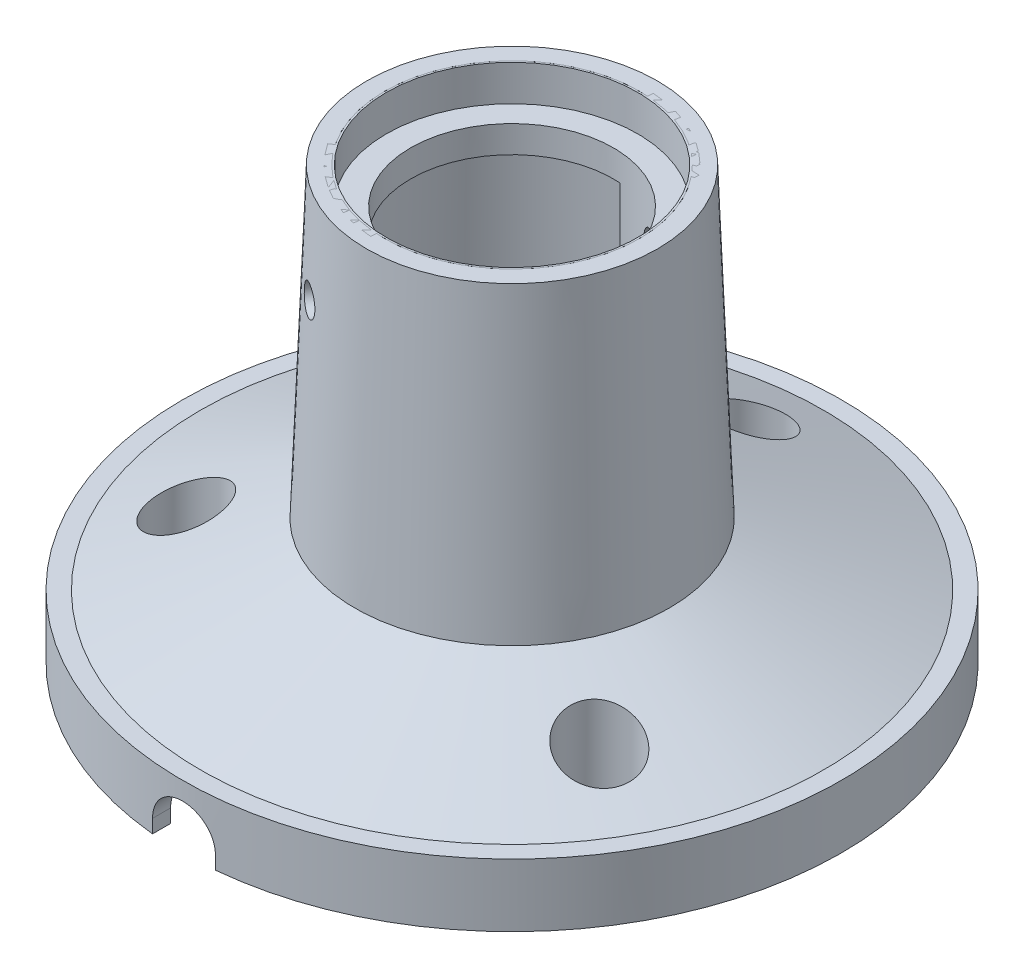
from build123d import *
from build123d.topology import SkipClean

# Parameters (mm, degrees)
SKETCH_4_R               = 3.9
CUT_EXTRUDE_1_DEPTH      = 46
SHELL_3_T                = -2
SKETCH_6_R               = 2.25
CUT_EXTRUDE_2_DEPTH      = 71.694978673
SKETCH_7_R               = 14.198538596
SKETCH_7_R_2             = 11.3
EXTRUDE_1_DEPTH          = 7
EXTRUDE_2_DEPTH          = 16
SKETCH_9_R               = 14
SKETCH_9_R_2             = 11.3
CUT_EXTRUDE_3_DEPTH      = 4
EXTRUDE_3_REACH          = 72.695
CUT_EXTRUDE_4_DEPTH      = 79.20824104
CUT_EXTRUDE_4_DEPTH_BACK = 79.20824104
SKETCH_11_R              = 1.6
CUT_EXTRUDE_5_DEPTH      = 71.694978673


with BuildPart() as part:
    # 스케치2 → 회전1 (revolve)
    with BuildSketch(Plane.XY, mode=Mode.PRIVATE) as revolve_1_sk:
        Polygon((0, 0), (36.7, 0), (36.7, 7), (34.7, 7), (17.5, 14), (16.2, 48), (0, 48), align=None)
    revolve(revolve_1_sk.sketch.rotate(Axis((0, 48, 0), (0, -1, 0)), 180), axis=Axis((0, 48, 0), (0, -1, 0)))

    # 스케치4 → 컷-돌출1 (cut)
    with BuildSketch(Plane(origin=(0, 48, 0), x_dir=(1, 0, 0), z_dir=(0, 1, 0))):
        with Locations(Location((0, 26.558112383, 0), (0, 0, 180))):
            Circle(SKETCH_4_R)
        with Locations(Location((-23, -13.279056191, 0), (0, 0, 180))):
            Circle(SKETCH_4_R)
        with Locations(Location((23, -13.279056191, 0), (0, 0, 180))):
            Circle(SKETCH_4_R)
    extrude(amount=-CUT_EXTRUDE_1_DEPTH, mode=Mode.SUBTRACT)

    # 쉘3
    shell_3_openings = [part.faces().sort_by_distance(p)[0] for p in [
        (0, 48, 0),
        (0, 0, 0),
    ]]
    offset(amount=SHELL_3_T, openings=shell_3_openings, kind=Kind.INTERSECTION)

    # 스케치6 → 컷-돌출2 (cut, through all)
    with BuildSketch(Plane(origin=(0, 48, 0), x_dir=(1, 0, 0), z_dir=(0, 1, 0))):
        with Locations(Location((0, 26.558112383, 0), (0, 0, 180))):
            Circle(SKETCH_6_R)
        with Locations(Location((-23, -13.279056191, 0), (0, 0, 180))):
            Circle(SKETCH_6_R)
        with Locations(Location((23, -13.279056191, 0), (0, 0, 180))):
            Circle(SKETCH_6_R)
    extrude(amount=-CUT_EXTRUDE_2_DEPTH, mode=Mode.SUBTRACT)

    # 보스-돌출3: up to this cone (the profile starts inside it)
    extrude_3_end = Plane(origin=(0, 0, 0), z_dir=(0, -1, 0)).offset(-18.962805039) * Cone(2.457e-06, 340.933803788, 138.752128448, align=(Align.CENTER, Align.CENTER, Align.MIN), mode=Mode.PRIVATE)
    # 스케치10 → 보스-돌출3 (add, up to the surface)
    with BuildSketch(Plane(origin=(0, 0, 0), x_dir=(1, 0, 0), z_dir=(0, 1, 0)), mode=Mode.PRIVATE) as extrude_3_sk1:
        with BuildLine():
            Line((-1, 35.298423202), (-1, 30.327727748))
            ThreePointArc((-1, 30.327727748), (0, 30.458112383), (1, 30.327727748))
            Line((1, 30.327727748), (1, 35.298423202))
            Line((1, 35.298423202), (-1, 35.298423202))
        make_face()
    extrude_3_tool1 = extrude(extrude_3_sk1.sketch, amount=EXTRUDE_3_REACH, mode=Mode.PRIVATE) & extrude_3_end
    add(extrude_3_tool1.solids().sort_by_distance((0, 0, -32.85653))[0])
    # 스케치10 → 보스-돌출3 (add, up to the surface)
    with BuildSketch(Plane(origin=(0, 0, 0), x_dir=(1, 0, 0), z_dir=(0, 1, 0)), mode=Mode.PRIVATE) as extrude_3_sk2:
        with BuildLine():
            Line((31.069331206, -16.783186197), (26.764582669, -14.29783847))
            ThreePointArc((26.764582669, -14.29783847), (26.377499075, -15.229056191), (25.764582669, -16.029889278))
            Line((25.764582669, -16.029889278), (30.069331206, -18.515237005))
            Line((30.069331206, -18.515237005), (31.069331206, -16.783186197))
        make_face()
    extrude_3_tool2 = extrude(extrude_3_sk2.sketch, amount=EXTRUDE_3_REACH, mode=Mode.PRIVATE) & extrude_3_end
    add(extrude_3_tool2.solids().sort_by_distance((28.45459, 0, 16.428265))[0])
    # 스케치10 → 보스-돌출3 (add, up to the surface)
    with BuildSketch(Plane(origin=(0, 0, 0), x_dir=(1, 0, 0), z_dir=(0, 1, 0)), mode=Mode.PRIVATE) as extrude_3_sk3:
        with BuildLine():
            Line((-30.069331206, -18.515237005), (-25.764582669, -16.029889278))
            ThreePointArc((-25.764582669, -16.029889278), (-26.377499075, -15.229056191), (-26.764582669, -14.29783847))
            Line((-26.764582669, -14.29783847), (-31.069331206, -16.783186197))
            Line((-31.069331206, -16.783186197), (-30.069331206, -18.515237005))
        make_face()
    extrude_3_tool3 = extrude(extrude_3_sk3.sketch, amount=EXTRUDE_3_REACH, mode=Mode.PRIVATE) & extrude_3_end
    add(extrude_3_tool3.solids().sort_by_distance((-28.45459, 0, 16.428265))[0])


with BuildPart() as body_2:
    # 스케치7 → 보스-돌출1 (new body)
    with BuildSketch(Plane(origin=(0, 48, 0), x_dir=(1, 0, 0), z_dir=(0, 1, 0))):
        with Locations(Location((0, 0, 0), (0, 0, 180))):
            Circle(SKETCH_7_R)
        with Locations(Location((0, 0, 0), (0, 0, 180))):
            Circle(SKETCH_7_R_2, mode=Mode.SUBTRACT)
    extrude(amount=-EXTRUDE_1_DEPTH)

    # 스케치8 → 보스-돌출2 (add)
    with SkipClean():  # the faces are left unmerged after this step: merging them gives an invalid solid
        with BuildSketch(Plane(origin=(0, 48, 0), x_dir=(1, 0, 0), z_dir=(0, 1, 0))):
            with BuildLine():
                Line((9.396930745, 6.275961486), (12.307484516, 8.219843362))
                ThreePointArc((12.307484516, 8.219843362), (7.4, 12.817175976), (0.964850909, 14.768515928))
                Line((0.964850909, 14.768515928), (0.736676707, 11.275961486))
                ThreePointArc((0.736676707, 11.275961486), (5.65, 9.786087063), (9.396930745, 6.275961486))
            make_face()
            with BuildLine():
                Line((-0.736676707, -11.275961486), (-0.964850909, -14.768515928))
                ThreePointArc((-0.964850909, -14.768515928), (-7.4, -12.817175976), (-12.307484516, -8.219843362))
                Line((-12.307484516, -8.219843362), (-9.396930745, -6.275961486))
                ThreePointArc((-9.396930745, -6.275961486), (-5.65, -9.786087063), (-0.736676707, -11.275961486))
            make_face()
        extrude(amount=-EXTRUDE_2_DEPTH)

    # 스케치9 → 컷-돌출3 (cut)
    with SkipClean():  # the faces are left unmerged after this step: merging them gives an invalid solid
        with BuildSketch(Plane(origin=(0, 48, 0), x_dir=(1, 0, 0), z_dir=(0, 1, 0))):
            with Locations(Location((0, 0, 0), (0, 0, 180))):
                Circle(SKETCH_9_R)
            with Locations(Location((0, 0, 0), (0, 0, 180))):
                Circle(SKETCH_9_R_2, mode=Mode.SUBTRACT)
        extrude(amount=-CUT_EXTRUDE_3_DEPTH, mode=Mode.SUBTRACT)


with BuildPart() as cut_extrude_4_tool:
    # 스케치11 → 컷-돌출4 (new, two sides: drawn at the far end of the back side and taken through both)
    with SkipClean():  # the faces are left unmerged after this step: merging them gives an invalid solid
        with BuildSketch(Plane(origin=(5.066803726, 0, -8.775961486), x_dir=(-0.8660254037844382, 0, -0.500000000000001), z_dir=(0.500000000000001, 0, -0.8660254037844382)).offset(-CUT_EXTRUDE_4_DEPTH_BACK)):
            with Locations((0, 38)):
                Circle(SKETCH_11_R)
        extrude(amount=CUT_EXTRUDE_4_DEPTH + CUT_EXTRUDE_4_DEPTH_BACK)


with BuildPart() as part_1:
    with SkipClean():  # the faces are left unmerged after this step: merging them gives an invalid solid
        add(part.part)

        # 컷-돌출4: cut by cut_extrude_4_tool
        add(cut_extrude_4_tool.part, mode=Mode.SUBTRACT)

    # 스케치12 → 컷-돌출5 (cut, through all)
    with BuildSketch(Plane.XY):
        with BuildLine():
            Line((-3.5, 0), (-3.5, 1.5))
            ThreePointArc((-3.5, 1.5), (0, 5), (3.5, 1.5))
            Line((3.5, 1.5), (3.5, 0))
            ThreePointArc((3.5, 0), (0, -3.5), (-3.5, 0))
        make_face()
    extrude(amount=CUT_EXTRUDE_5_DEPTH, mode=Mode.SUBTRACT)


with BuildPart() as body_2_1:
    with SkipClean():  # the faces are left unmerged after this step: merging them gives an invalid solid
        add(body_2.part)

        # 컷-돌출4: cut by cut_extrude_4_tool
        add(cut_extrude_4_tool.part, mode=Mode.SUBTRACT)


solid = Compound([part_1.part, body_2_1.part])
